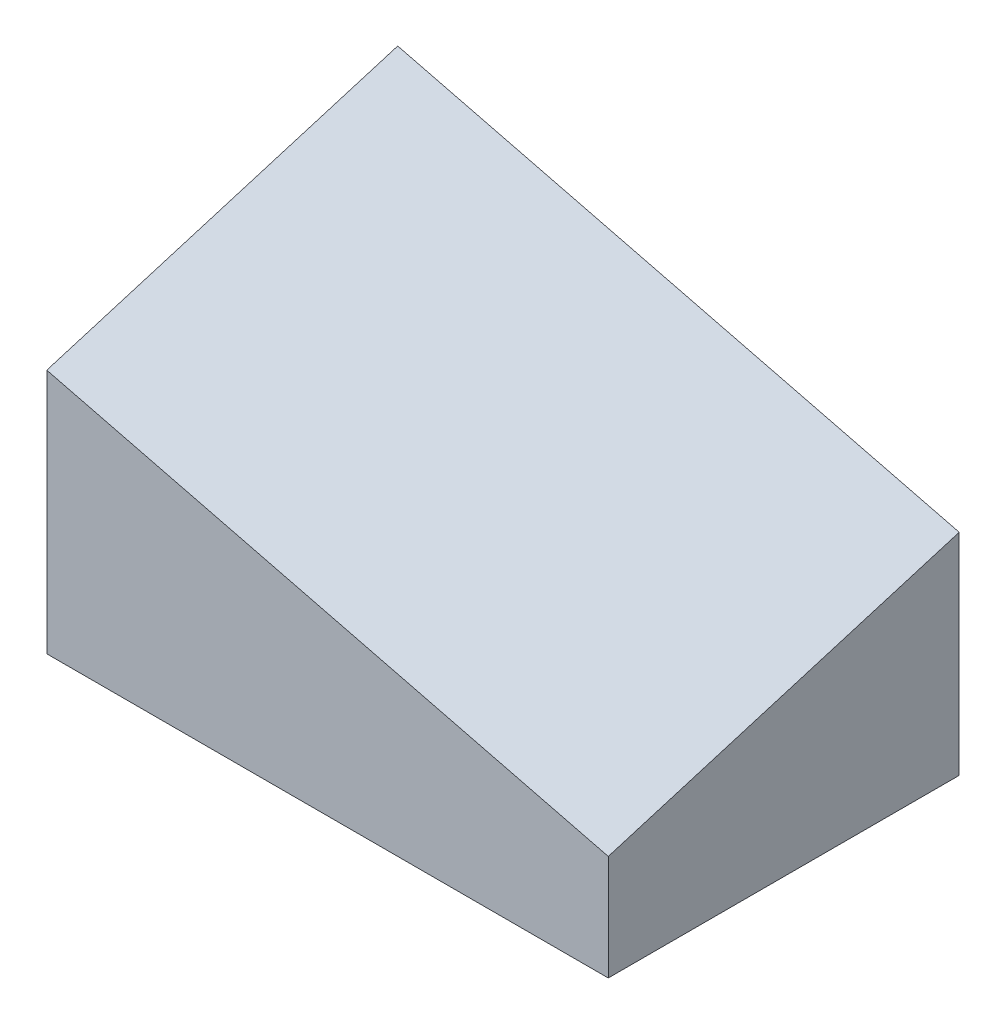
from build123d import *

# Parameters (mm, degrees)
SKETCH7_W           = 4
SKETCH7_H           = 2.5
BOSS_EXTRUDE4_DEPTH = 2.5
CUT_EXTRUDE1_DEPTH  = 2.5


with BuildPart() as part:
    # Sketch7 → Boss-Extrude4 (new body)
    with BuildSketch(Plane(origin=(0, 0, 0), x_dir=(1, 0, 0), z_dir=(0, 1, 0))):
        Rectangle(SKETCH7_W, SKETCH7_H)
    extrude(amount=BOSS_EXTRUDE4_DEPTH)

    # 3DSketch1 → Cut-Extrude1 (cut, along a direction that is not the sketch's normal)
    with BuildSketch(Plane(origin=(-2, 2.5, -1.25), x_dir=(0.7950463919999253, -0.3478327964999673, 0.4969039949999533), z_dir=(-0.23287321641631112, -0.9314928656652447, -0.2794478596995734))):
        Polygon((0, 0), (1.503134585, 2.133796246), (5.031152949, 0), (3.528018364, -2.133796246), align=None)
    extrude(amount=-CUT_EXTRUDE1_DEPTH, dir=(0, -1, 0), mode=Mode.SUBTRACT)


solid = part.part
